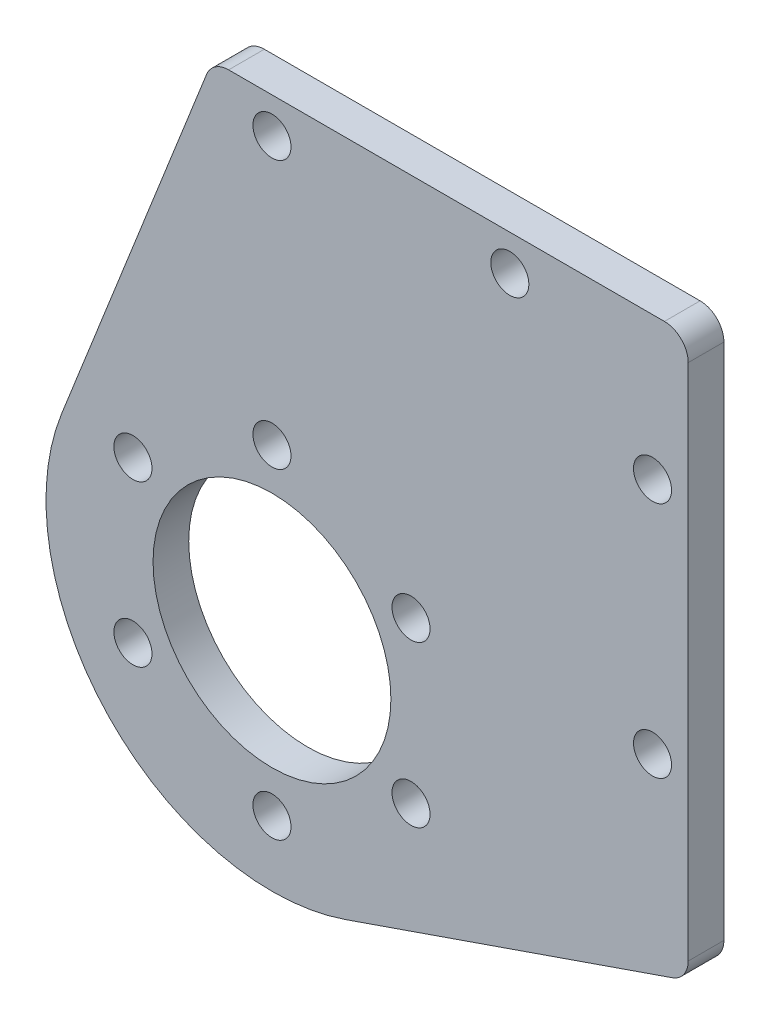
from build123d import *

# Parameters (mm, degrees)
SKETCH_1_R      = 19
SKETCH_1_R_2    = 10
SKETCH_1_R_3    = 1.6
EXTRUDE_1_DEPTH = 3
EXTRUDE_START   = -3
SKETCH_2_R      = 1.6
EXTRUDE_3_DEPTH = 3


with BuildPart() as part:
    # 草图1 → 凸台-拉伸1 (new body)
    with BuildSketch(Plane.XY):
        Circle(SKETCH_1_R)
        Circle(SKETCH_1_R_2, mode=Mode.SUBTRACT)
        with Locations((0, 13.5)):
            Circle(SKETCH_1_R_3, mode=Mode.SUBTRACT)
        with Locations((11.691342951, 6.75)):
            Circle(SKETCH_1_R_3, mode=Mode.SUBTRACT)
        with Locations((11.691342951, -6.75)):
            Circle(SKETCH_1_R_3, mode=Mode.SUBTRACT)
        with Locations((0, -13.5)):
            Circle(SKETCH_1_R_3, mode=Mode.SUBTRACT)
        with Locations((-11.691342951, -6.75)):
            Circle(SKETCH_1_R_3, mode=Mode.SUBTRACT)
        with Locations((-11.691342951, 6.75)):
            Circle(SKETCH_1_R_3, mode=Mode.SUBTRACT)
    extrude(amount=EXTRUDE_1_DEPTH)

    # 草图2 → 凸台-拉伸3 (add)
    with BuildSketch(Plane.XY.offset(3).offset(EXTRUDE_START)):
        with BuildLine():
            Line((35, -6.575441021), (35, 37))
            ThreePointArc((35, 37), (34.414213562, 38.414213562), (33, 39))
            Line((33, 39), (-3.640557622, 39))
            ThreePointArc((-3.640557622, 39), (-4.764862291, 38.654067414), (-5.500233339, 37.735939011))
            Line((-5.500233339, 37.735939011), (-17.666919312, 6.991420601))
            ThreePointArc((-17.666919312, 6.991420601), (13.726454821, 13.137139645), (6.209937899, -17.956521692))
            Line((6.209937899, -17.956521692), (33.653677674, -8.4656012))
            ThreePointArc((33.653677674, -8.4656012), (34.629011256, -7.735752327), (35, -6.575441021))
        make_face()
        with Locations((32, 7)):
            Circle(SKETCH_2_R, mode=Mode.SUBTRACT)
        with Locations((32, 27)):
            Circle(SKETCH_2_R, mode=Mode.SUBTRACT)
        with Locations((0, 36)):
            Circle(SKETCH_2_R, mode=Mode.SUBTRACT)
        with Locations((20, 36)):
            Circle(SKETCH_2_R, mode=Mode.SUBTRACT)
    extrude(amount=EXTRUDE_3_DEPTH)


solid = part.part
